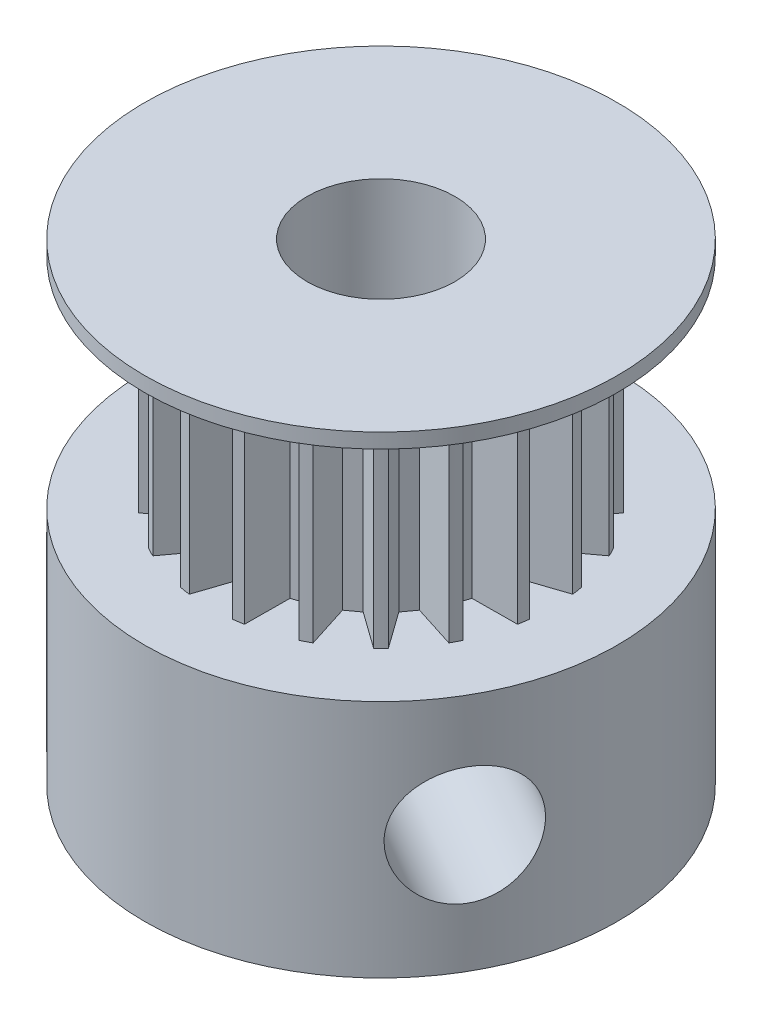
from build123d import *

# Parameters (mm, degrees)
SKETCH11_R               = 8
BOSS_EXTRUDE5_DEPTH      = 15.5
SKETCH12_R               = 2.5
CUT_EXTRUDE9_DEPTH       = 20.189841062
CUT_EXTRUDE11_START      = -7.4
SKETCH14_R               = 8
SKETCH14_R_2             = 5.8
CUT_EXTRUDE11_DEPTH      = 7.4
CUT_EXTRUDE12_DEPTH      = 7.4
CIRPATTERN5_COUNT        = 20
SKETCH16_R               = 8
BOSS_EXTRUDE6_DEPTH      = 0.5
SKETCH17_R               = 2.5
CUT_EXTRUDE13_DEPTH      = 20.189841062
CUT_EXTRUDE14_REACH      = 21.596
CUT_EXTRUDE14_END_RADIUS = 8
SKETCH18_R               = 2
CIRPATTERN6_COUNT        = 3


with BuildPart() as part:
    # Sketch11 → Boss-Extrude5 (new body)
    with BuildSketch(Plane(origin=(0, 0, 0), x_dir=(1, 0, 0), z_dir=(0, 1, 0))):
        with Locations(Location((0, 0, 0), (0, 0, 270))):
            Circle(SKETCH11_R)
    extrude(amount=BOSS_EXTRUDE5_DEPTH)

    # Sketch12 → Cut-Extrude9 (cut, through all)
    with BuildSketch(Plane(origin=(0, 15.5, 0), x_dir=(1, 0, 0), z_dir=(0, 1, 0))):
        with Locations(Location((0, 0, 0), (0, 0, 270))):
            Circle(SKETCH12_R)
    extrude(amount=-CUT_EXTRUDE9_DEPTH, mode=Mode.SUBTRACT)

    # Sketch14 → Cut-Extrude11 (cut)
    with BuildSketch(Plane(origin=(0, 15.5, 0), x_dir=(1, 0, 0), z_dir=(0, 1, 0)).offset(CUT_EXTRUDE11_START)):
        with Locations(Location((0, 0, 0), (0, 0, 270))):
            Circle(SKETCH14_R)
        with Locations(Location((0, 0, 0), (0, 0, 270))):
            Circle(SKETCH14_R_2, mode=Mode.SUBTRACT)
    extrude(amount=CUT_EXTRUDE11_DEPTH, mode=Mode.SUBTRACT)

    # Sketch15 → Cut-Extrude12 (cut)
    with BuildSketch(Plane(origin=(0, 15.5, 0), x_dir=(1, 0, 0), z_dir=(0, 1, 0))):
        Polygon((-0.75, 5.8), (0.75, 5.8), (0.25, 4.3), (-0.25, 4.3), align=None)
    cut_extrude12 = extrude(amount=-CUT_EXTRUDE12_DEPTH, mode=Mode.SUBTRACT)

    # CirPattern5: Cut-Extrude12 ×20 about axis
    cirpattern5_axis = Axis((0, 0, 0), (0, 1, 0))
    for i in range(1, CIRPATTERN5_COUNT):
        add(cut_extrude12.rotate(cirpattern5_axis, i * 360 / CIRPATTERN5_COUNT), mode=Mode.SUBTRACT)

    # Sketch16 → Boss-Extrude6 (add)
    with BuildSketch(Plane(origin=(0, 15.5, 0), x_dir=(1, 0, 0), z_dir=(0, 1, 0))):
        with Locations(Location((0, 0, 0), (0, 0, 270))):
            Circle(SKETCH16_R)
    extrude(amount=BOSS_EXTRUDE6_DEPTH)

    # Sketch17 → Cut-Extrude13 (cut, through all)
    with BuildSketch(Plane.XZ.offset(-15.5)):
        with Locations(Location((0, 0, 0), (0, 0, 90))):
            Circle(SKETCH17_R)
    extrude(amount=-CUT_EXTRUDE13_DEPTH, mode=Mode.SUBTRACT)

    # Cut-Extrude14: up to this cylinder (the profile starts inside it)
    cut_extrude14_end = Plane(origin=(0, 4, 0), z_dir=(0, -1, 0)) * Cylinder(CUT_EXTRUDE14_END_RADIUS, 60.192, mode=Mode.PRIVATE)
    # Sketch18 → Cut-Extrude14 (cut, up to the surface)
    with BuildSketch(Plane.XY, mode=Mode.PRIVATE) as cut_extrude14_sk1:
        with Locations((0, 4)):
            Circle(SKETCH18_R)
    cut_extrude14_tool1 = extrude(cut_extrude14_sk1.sketch, amount=-CUT_EXTRUDE14_REACH, mode=Mode.PRIVATE) & cut_extrude14_end
    cut_extrude14 = cut_extrude14_tool1.solids().sort_by_distance((0, 4, 0))[0]
    add(cut_extrude14, mode=Mode.SUBTRACT)

    # CirPattern6: Cut-Extrude14 ×3 about axis
    cirpattern6_axis = Axis((0, 0, 0), (0, 1, 0))
    for i in range(1, CIRPATTERN6_COUNT):
        add(cut_extrude14.rotate(cirpattern6_axis, i * 360 / CIRPATTERN6_COUNT), mode=Mode.SUBTRACT)


solid = part.part
